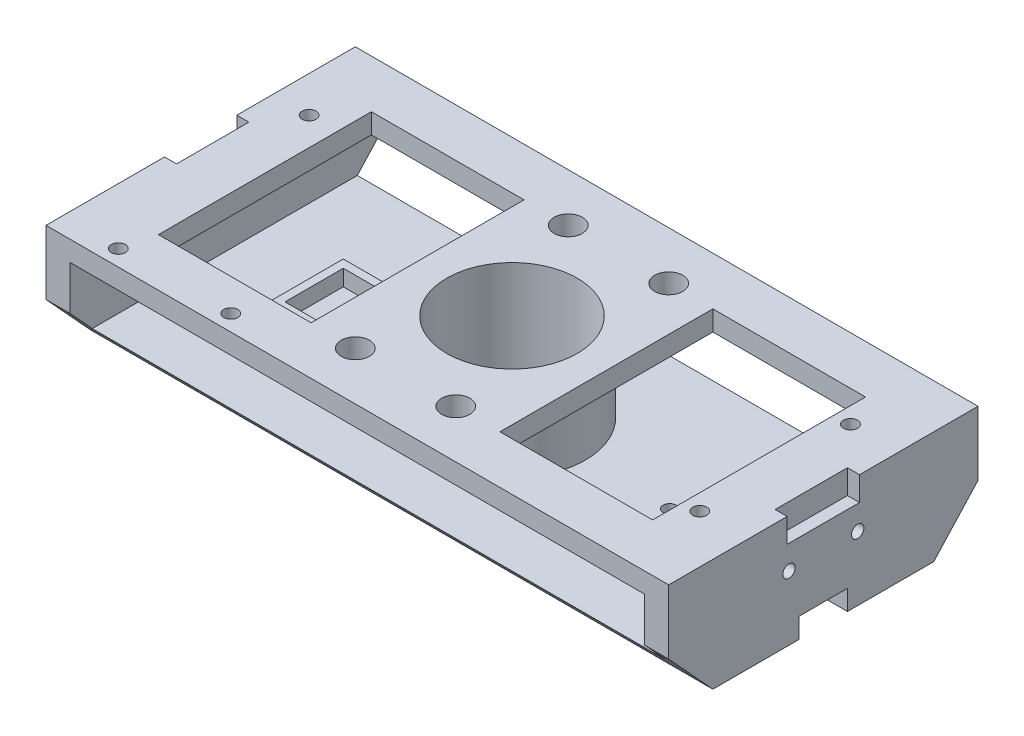
from build123d import *

# Parameters (mm, degrees)
SKETCH3_W           = 155
SKETCH3_H           = 77
BOSS_EXTRUDE1_DEPTH = 28
SKETCH5_W           = 143
SKETCH5_H           = 17
CUT_EXTRUDE1_DEPTH  = 113.77965242
BOSS_EXTRUDE3_REACH = 91.289
SKETCH12_R          = 18.25
SKETCH15_R          = 16.25
CUT_EXTRUDE4_DEPTH  = 27
CUT_EXTRUDE5_REACH  = 92.953
SKETCH16_R          = 3.5
SKETCH16_W          = 38
SKETCH16_H          = 53
SKETCH19_W          = 10
SKETCH19_H          = 12
CUT_EXTRUDE6_DEPTH  = 5
CUT_EXTRUDE7_DEPTH  = 163.145767752
CUT_EXTRUDE8_REACH  = 92.953
SKETCH23_R          = 1.625
SKETCH28_W          = 24
SKETCH28_H          = 18.5
BOSS_EXTRUDE4_DEPTH = 4
SKETCH29_W          = 20
SKETCH29_H          = 14.5
CUT_EXTRUDE11_DEPTH = 4
SKETCH30_R          = 3.25
CUT_EXTRUDE12_DEPTH = 1.5
CUT_EXTRUDE13_REACH = 164.146
SKETCH31_R          = 1.55
CUT_EXTRUDE14_REACH = 164.146
SKETCH32_R          = 1.55
SKETCH33_W          = 18
SKETCH33_H          = 6
CUT_EXTRUDE15_DEPTH = 3
SKETCH34_W          = 18
SKETCH34_H          = 6
CUT_EXTRUDE16_DEPTH = 3
SKETCH35_R          = 3.75
CUT_EXTRUDE17_DEPTH = 90.288857088
CUT_EXTRUDE18_REACH = 92.953
SKETCH36_R          = 1.75


with BuildPart() as part:
    # Sketch3 → Boss-Extrude1 (new body)
    with BuildSketch(Plane(origin=(0, 0, 0), x_dir=(1, 0, 0), z_dir=(0, 1, 0))):
        Rectangle(SKETCH3_W, SKETCH3_H)
    extrude(amount=BOSS_EXTRUDE1_DEPTH)

    # Sketch5 → Cut-Extrude1 (cut, through all)
    with BuildSketch(Plane.XY.offset(38.5)):
        with Locations((0, 14.5)):
            Rectangle(SKETCH5_W, SKETCH5_H)
    extrude(amount=-CUT_EXTRUDE1_DEPTH, mode=Mode.SUBTRACT)

    # Sketch12 → Boss-Extrude3 (add, up to next)
    with BuildSketch(Plane(origin=(0, 6, 0), x_dir=(1, 0, 0), z_dir=(0, 1, 0)), mode=Mode.PRIVATE) as boss_extrude3_sk1:
        with Locations(Location((0, 0, 0), (0, 0, 90))):
            Circle(SKETCH12_R)
    boss_extrude3_tool1 = extrude(boss_extrude3_sk1.sketch, amount=BOSS_EXTRUDE3_REACH, mode=Mode.PRIVATE) - part.part
    add(boss_extrude3_tool1.solids().sort_by_distance((0, 6, 0))[0])

    # Sketch15 → Cut-Extrude4 (cut)
    with BuildSketch(Plane(origin=(0, 28, 0), x_dir=(1, 0, 0), z_dir=(0, 1, 0))):
        with Locations(Location((0, 0, 0), (0, 0, 270))):
            Circle(SKETCH15_R)
    extrude(amount=-CUT_EXTRUDE4_DEPTH, mode=Mode.SUBTRACT)

    # Sketch16 → Cut-Extrude5 (cut, up to next)
    with BuildSketch(Plane(origin=(0, 28, 0), x_dir=(1, 0, 0), z_dir=(0, 1, 0)), mode=Mode.PRIVATE) as cut_extrude5_sk1:
        with Locations(Location((-12.5, 26.5, 0), (0, 0, 270))):
            Circle(SKETCH16_R)
    cut_extrude5_tool1 = extrude(cut_extrude5_sk1.sketch, amount=-CUT_EXTRUDE5_REACH, mode=Mode.PRIVATE) & part.part
    # Sketch16 → Cut-Extrude5 (cut, up to next)
    with BuildSketch(Plane(origin=(0, 28, 0), x_dir=(1, 0, 0), z_dir=(0, 1, 0)), mode=Mode.PRIVATE) as cut_extrude5_sk2:
        with Locations(Location((12.5, 26.5, 0), (0, 0, 270))):
            Circle(SKETCH16_R)
    cut_extrude5_tool2 = extrude(cut_extrude5_sk2.sketch, amount=-CUT_EXTRUDE5_REACH, mode=Mode.PRIVATE) & part.part
    # Sketch16 → Cut-Extrude5 (cut, up to next)
    with BuildSketch(Plane(origin=(0, 28, 0), x_dir=(1, 0, 0), z_dir=(0, 1, 0)), mode=Mode.PRIVATE) as cut_extrude5_sk3:
        with Locations(Location((12.5, -26.5, 0), (0, 0, 270))):
            Circle(SKETCH16_R)
    cut_extrude5_tool3 = extrude(cut_extrude5_sk3.sketch, amount=-CUT_EXTRUDE5_REACH, mode=Mode.PRIVATE) & part.part
    # Sketch16 → Cut-Extrude5 (cut, up to next)
    with BuildSketch(Plane(origin=(0, 28, 0), x_dir=(1, 0, 0), z_dir=(0, 1, 0)), mode=Mode.PRIVATE) as cut_extrude5_sk4:
        with Locations(Location((-12.5, -26.5, 0), (0, 0, 270))):
            Circle(SKETCH16_R)
    cut_extrude5_tool4 = extrude(cut_extrude5_sk4.sketch, amount=-CUT_EXTRUDE5_REACH, mode=Mode.PRIVATE) & part.part
    # Sketch16 → Cut-Extrude5 (cut, up to next)
    with BuildSketch(Plane(origin=(0, 28, 0), x_dir=(1, 0, 0), z_dir=(0, 1, 0)), mode=Mode.PRIVATE) as cut_extrude5_sk5:
        with Locations((-42.5, 0)):
            Rectangle(SKETCH16_W, SKETCH16_H)
    cut_extrude5_tool5 = extrude(cut_extrude5_sk5.sketch, amount=-CUT_EXTRUDE5_REACH, mode=Mode.PRIVATE) & part.part
    # Sketch16 → Cut-Extrude5 (cut, up to next)
    with BuildSketch(Plane(origin=(0, 28, 0), x_dir=(1, 0, 0), z_dir=(0, 1, 0)), mode=Mode.PRIVATE) as cut_extrude5_sk6:
        with Locations((42.5, 0)):
            Rectangle(SKETCH16_W, SKETCH16_H)
    cut_extrude5_tool6 = extrude(cut_extrude5_sk6.sketch, amount=-CUT_EXTRUDE5_REACH, mode=Mode.PRIVATE) & part.part
    add(cut_extrude5_tool1.solids().sort_by_distance((-12.5, 28, -26.5))[0], mode=Mode.SUBTRACT)
    add(cut_extrude5_tool2.solids().sort_by_distance((12.5, 28, -26.5))[0], mode=Mode.SUBTRACT)
    add(cut_extrude5_tool3.solids().sort_by_distance((12.5, 28, 26.5))[0], mode=Mode.SUBTRACT)
    add(cut_extrude5_tool4.solids().sort_by_distance((-12.5, 28, 26.5))[0], mode=Mode.SUBTRACT)
    add(cut_extrude5_tool5.solids().sort_by_distance((-42.5, 28, 0))[0], mode=Mode.SUBTRACT)
    add(cut_extrude5_tool6.solids().sort_by_distance((42.5, 28, 0))[0], mode=Mode.SUBTRACT)

    # Sketch19 → Cut-Extrude6 (cut)
    with BuildSketch(Plane.XZ):
        with Locations((-72.5, 0)):
            Rectangle(SKETCH19_W, SKETCH19_H)
        with Locations((72.5, 0)):
            Rectangle(SKETCH19_W, SKETCH19_H)
    extrude(amount=-CUT_EXTRUDE6_DEPTH, mode=Mode.SUBTRACT)

    # Sketch22 → Cut-Extrude7 (cut, through all)
    with BuildSketch(Plane.ZY.offset(77.5)):
        Polygon((-38.5, 0), (-38.5, 12), (-27.5, 0), align=None)
        Polygon((38.5, 12), (27.5, 0), (38.5, 0), align=None)
    extrude(amount=-CUT_EXTRUDE7_DEPTH, mode=Mode.SUBTRACT)

    # Sketch23 → Cut-Extrude8 (cut, up to next)
    with BuildSketch(Plane.XZ, mode=Mode.PRIVATE) as cut_extrude8_sk1:
        with Locations(Location((39.25, 0, 0), (0, 0, 270))):
            Circle(SKETCH23_R)
    cut_extrude8_tool1 = extrude(cut_extrude8_sk1.sketch, amount=-CUT_EXTRUDE8_REACH, mode=Mode.PRIVATE) & part.part
    # Sketch23 → Cut-Extrude8 (cut, up to next)
    with BuildSketch(Plane.XZ, mode=Mode.PRIVATE) as cut_extrude8_sk2:
        with Locations(Location((-39.25, 0, 0), (0, 0, 270))):
            Circle(SKETCH23_R)
    cut_extrude8_tool2 = extrude(cut_extrude8_sk2.sketch, amount=-CUT_EXTRUDE8_REACH, mode=Mode.PRIVATE) & part.part
    add(cut_extrude8_tool1.solids().sort_by_distance((39.25, 0, 0))[0], mode=Mode.SUBTRACT)
    add(cut_extrude8_tool2.solids().sort_by_distance((-39.25, 0, 0))[0], mode=Mode.SUBTRACT)

    # Sketch28 → Boss-Extrude4 (add)
    with BuildSketch(Plane(origin=(0, 6, 0), x_dir=(1, 0, 0), z_dir=(0, 1, 0))):
        with Locations((-39.25, 0)):
            Rectangle(SKETCH28_W, SKETCH28_H)
    extrude(amount=BOSS_EXTRUDE4_DEPTH)

    # Sketch29 → Cut-Extrude11 (cut)
    with BuildSketch(Plane(origin=(0, 10, 0), x_dir=(1, 0, 0), z_dir=(0, 1, 0))):
        with Locations((-39.25, 0)):
            Rectangle(SKETCH29_W, SKETCH29_H)
    extrude(amount=-CUT_EXTRUDE11_DEPTH, mode=Mode.SUBTRACT)

    # Sketch30 → Cut-Extrude12 (cut)
    with BuildSketch(Plane(origin=(0, 6, 0), x_dir=(1, 0, 0), z_dir=(0, 1, 0))):
        with Locations(Location((-39.25, 0, 0), (0, 0, 270))):
            Circle(SKETCH30_R)
    extrude(amount=-CUT_EXTRUDE12_DEPTH, mode=Mode.SUBTRACT)

    # Sketch31 → Cut-Extrude13 (cut, up to next)
    with BuildSketch(Plane(origin=(77.5, 0, 0), x_dir=(0, 0, -1), z_dir=(1, 0, 0)), mode=Mode.PRIVATE) as cut_extrude13_sk1:
        with Locations((-8.55, 16)):
            Circle(SKETCH31_R)
    cut_extrude13_tool1 = extrude(cut_extrude13_sk1.sketch, amount=-CUT_EXTRUDE13_REACH, mode=Mode.PRIVATE) & part.part
    # Sketch31 → Cut-Extrude13 (cut, up to next)
    with BuildSketch(Plane(origin=(77.5, 0, 0), x_dir=(0, 0, -1), z_dir=(1, 0, 0)), mode=Mode.PRIVATE) as cut_extrude13_sk2:
        with Locations((8.55, 16)):
            Circle(SKETCH31_R)
    cut_extrude13_tool2 = extrude(cut_extrude13_sk2.sketch, amount=-CUT_EXTRUDE13_REACH, mode=Mode.PRIVATE) & part.part
    add(cut_extrude13_tool1.solids().sort_by_distance((77.5, 16, 8.55))[0], mode=Mode.SUBTRACT)
    add(cut_extrude13_tool2.solids().sort_by_distance((77.5, 16, -8.55))[0], mode=Mode.SUBTRACT)

    # Sketch32 → Cut-Extrude14 (cut, up to next)
    with BuildSketch(Plane.ZY.offset(77.5), mode=Mode.PRIVATE) as cut_extrude14_sk1:
        with Locations(Location((-8.55, 16, 0), (0, 0, 180))):
            Circle(SKETCH32_R)
    cut_extrude14_tool1 = extrude(cut_extrude14_sk1.sketch, amount=-CUT_EXTRUDE14_REACH, mode=Mode.PRIVATE) & part.part
    # Sketch32 → Cut-Extrude14 (cut, up to next)
    with BuildSketch(Plane.ZY.offset(77.5), mode=Mode.PRIVATE) as cut_extrude14_sk2:
        with Locations(Location((8.55, 16, 0), (0, 0, 180))):
            Circle(SKETCH32_R)
    cut_extrude14_tool2 = extrude(cut_extrude14_sk2.sketch, amount=-CUT_EXTRUDE14_REACH, mode=Mode.PRIVATE) & part.part
    add(cut_extrude14_tool1.solids().sort_by_distance((-77.5, 16, -8.55))[0], mode=Mode.SUBTRACT)
    add(cut_extrude14_tool2.solids().sort_by_distance((-77.5, 16, 8.55))[0], mode=Mode.SUBTRACT)

    # Sketch33 → Cut-Extrude15 (cut)
    with BuildSketch(Plane.ZY.offset(77.5)):
        with Locations((0, 25)):
            Rectangle(SKETCH33_W, SKETCH33_H)
    extrude(amount=-CUT_EXTRUDE15_DEPTH, mode=Mode.SUBTRACT)

    # Sketch34 → Cut-Extrude16 (cut)
    with BuildSketch(Plane(origin=(77.5, 0, 0), x_dir=(0, 0, -1), z_dir=(1, 0, 0))):
        with Locations((0, 25)):
            Rectangle(SKETCH34_W, SKETCH34_H)
    extrude(amount=-CUT_EXTRUDE16_DEPTH, mode=Mode.SUBTRACT)

    # Sketch35 → Cut-Extrude17 (cut, through all)
    with BuildSketch(Plane(origin=(0, 6, 0), x_dir=(1, 0, 0), z_dir=(0, 1, 0))):
        with Locations(Location((62.75, 0, 0), (0, 0, 270))):
            Circle(SKETCH35_R)
    extrude(amount=-CUT_EXTRUDE17_DEPTH, mode=Mode.SUBTRACT)

    # Sketch36 → Cut-Extrude18 (cut, up to next)
    with BuildSketch(Plane(origin=(0, 28, 0), x_dir=(1, 0, 0), z_dir=(0, 1, 0)), mode=Mode.PRIVATE) as cut_extrude18_sk1:
        with Locations(Location((-63.5, -34.5, 0), (0, 0, 270))):
            Circle(SKETCH36_R)
    cut_extrude18_tool1 = extrude(cut_extrude18_sk1.sketch, amount=-CUT_EXTRUDE18_REACH, mode=Mode.PRIVATE) & part.part
    # Sketch36 → Cut-Extrude18 (cut, up to next)
    with BuildSketch(Plane(origin=(0, 28, 0), x_dir=(1, 0, 0), z_dir=(0, 1, 0)), mode=Mode.PRIVATE) as cut_extrude18_sk2:
        with Locations(Location((-68.5, 18, 0), (0, 0, 270))):
            Circle(SKETCH36_R)
    cut_extrude18_tool2 = extrude(cut_extrude18_sk2.sketch, amount=-CUT_EXTRUDE18_REACH, mode=Mode.PRIVATE) & part.part
    # Sketch36 → Cut-Extrude18 (cut, up to next)
    with BuildSketch(Plane(origin=(0, 28, 0), x_dir=(1, 0, 0), z_dir=(0, 1, 0)), mode=Mode.PRIVATE) as cut_extrude18_sk3:
        with Locations(Location((-35.5, -34.5, 0), (0, 0, 270))):
            Circle(SKETCH36_R)
    cut_extrude18_tool3 = extrude(cut_extrude18_sk3.sketch, amount=-CUT_EXTRUDE18_REACH, mode=Mode.PRIVATE) & part.part
    # Sketch36 → Cut-Extrude18 (cut, up to next)
    with BuildSketch(Plane(origin=(0, 28, 0), x_dir=(1, 0, 0), z_dir=(0, 1, 0)), mode=Mode.PRIVATE) as cut_extrude18_sk4:
        with Locations(Location((65.5, -18.75, 0), (0, 0, 270))):
            Circle(SKETCH36_R)
    cut_extrude18_tool4 = extrude(cut_extrude18_sk4.sketch, amount=-CUT_EXTRUDE18_REACH, mode=Mode.PRIVATE) & part.part
    # Sketch36 → Cut-Extrude18 (cut, up to next)
    with BuildSketch(Plane(origin=(0, 28, 0), x_dir=(1, 0, 0), z_dir=(0, 1, 0)), mode=Mode.PRIVATE) as cut_extrude18_sk5:
        with Locations(Location((65.5, 18.75, 0), (0, 0, 270))):
            Circle(SKETCH36_R)
    cut_extrude18_tool5 = extrude(cut_extrude18_sk5.sketch, amount=-CUT_EXTRUDE18_REACH, mode=Mode.PRIVATE) & part.part
    add(cut_extrude18_tool1.solids().sort_by_distance((-63.5, 28, 34.5))[0], mode=Mode.SUBTRACT)
    add(cut_extrude18_tool2.solids().sort_by_distance((-68.5, 28, -18))[0], mode=Mode.SUBTRACT)
    add(cut_extrude18_tool3.solids().sort_by_distance((-35.5, 28, 34.5))[0], mode=Mode.SUBTRACT)
    add(cut_extrude18_tool4.solids().sort_by_distance((65.5, 28, 18.75))[0], mode=Mode.SUBTRACT)
    add(cut_extrude18_tool5.solids().sort_by_distance((65.5, 28, -18.75))[0], mode=Mode.SUBTRACT)


solid = part.part
